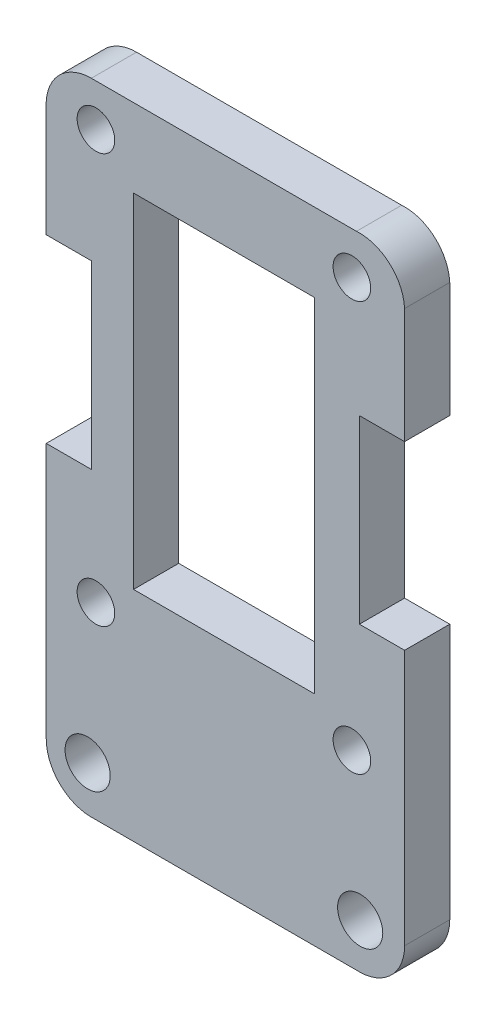
from build123d import *

# Parameters (mm, degrees)
SKETCH_1_R      = 1.25
SKETCH_1_R_2    = 1.5
SKETCH_1_W      = 12.000960833
SKETCH_1_H      = 22.8
EXTRUDE_1_DEPTH = 3


with BuildPart() as part:
    # 草圖1 → 填料-伸長1 (new body)
    with BuildSketch(Plane.XY):
        with BuildLine():
            Line((224.799401664, 107.985882496), (221.799401664, 107.985882496))
            Line((221.799401664, 107.985882496), (221.799401664, 119.985882496))
            Line((221.799401664, 119.985882496), (224.799369028, 119.985882496))
            Line((224.799369028, 119.985882496), (224.799401664, 127.645063489))
            ThreePointArc((224.799401664, 127.645063489), (223.796832359, 129.736024952), (221.603142855, 130.487684059))
            Line((221.603142855, 130.487684059), (203.993498606, 130.487684059))
            ThreePointArc((203.993498606, 130.487684059), (201.928341095, 129.663767205), (200.997480004, 127.64455643))
            Line((200.997480004, 127.64455643), (200.997480004, 119.985882496))
            Line((200.997480004, 119.985882496), (203.997720212, 119.985882496))
            Line((203.997720212, 119.985882496), (203.997720212, 107.985882496))
            Line((203.997720212, 107.985882496), (200.997480004, 107.985882496))
            Line((200.997480004, 107.985882496), (200.997480004, 90.984521316))
            ThreePointArc((200.997480004, 90.984521316), (201.841197388, 88.898693406), (203.897756422, 87.985949173))
            Line((203.897756422, 87.985949173), (221.799361625, 87.987966928))
            ThreePointArc((221.799361625, 87.987966928), (223.920611625, 88.866716927), (224.799361625, 90.987966928))
            Line((224.799361625, 90.987966928), (224.799401664, 107.985882496))
        make_face()
        with Locations((204.297950444, 127.688016928)):
            Circle(SKETCH_1_R, mode=Mode.SUBTRACT)
        with Locations((221.299311625, 127.688016928)):
            Circle(SKETCH_1_R, mode=Mode.SUBTRACT)
        with Locations((221.299311625, 100.485839038)):
            Circle(SKETCH_1_R, mode=Mode.SUBTRACT)
        with Locations((221.849455668, 90.985078375)):
            Circle(SKETCH_1_R_2, mode=Mode.SUBTRACT)
        with Locations((203.748006411, 90.985078375)):
            Circle(SKETCH_1_R_2, mode=Mode.SUBTRACT)
        with Locations((204.297950444, 100.485839038)):
            Circle(SKETCH_1_R, mode=Mode.SUBTRACT)
        with Locations((212.79832073, 113.885949173)):
            Rectangle(SKETCH_1_W, SKETCH_1_H, mode=Mode.SUBTRACT)
    extrude(amount=EXTRUDE_1_DEPTH)


solid = part.part
